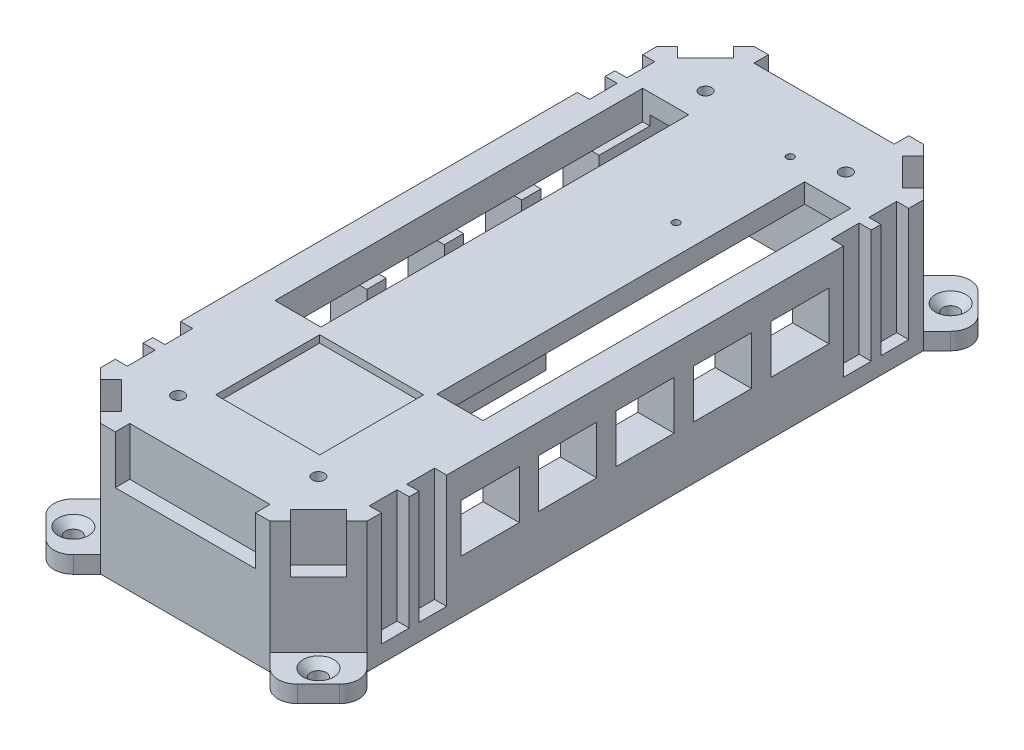
from build123d import *

# Parameters (mm, degrees)
SKETCH2_W                                       = 55
SKETCH2_H                                       = 135
BOSS_EXTRUDE1_DEPTH                             = 27
SKETCH3_W                                       = 40
SKETCH3_H                                       = 120
CUT_EXTRUDE1_DEPTH                              = 23
SKETCH19_W                                      = 12
SKETCH19_H                                      = 10
CUT_EXTRUDE7_DEPTH                              = 55
SKETCH20_R                                      = 1.25
SKETCH20_W                                      = 9.5
SKETCH20_H                                      = 76
CUT_EXTRUDE8_DEPTH                              = 6
CHAMFER1_SIZE                                   = 10
SKETCH22_R                                      = 0.75
CUT_EXTRUDE10_DEPTH                             = 10
SKETCH23_W                                      = 21.5
SKETCH23_H                                      = 21.5
CUT_EXTRUDE11_DEPTH                             = 1.5
SKETCH24_W                                      = 16
SKETCH24_H                                      = 24
BOSS_EXTRUDE2_DEPTH                             = 7
SKETCH26_W                                      = 11
SKETCH26_H                                      = 4.5
CUT_EXTRUDE13_DEPTH                             = 24
SKETCH27_W                                      = 14.142135623
SKETCH27_H                                      = 3.5
BOSS_EXTRUDE3_DEPTH                             = 8
SKETCH31_W                                      = 29
SKETCH31_H                                      = 10
CUT_EXTRUDE17_DEPTH                             = 3
SKETCH32_W                                      = 8.142135623
SKETCH32_H                                      = 10
CUT_EXTRUDE18_DEPTH                             = 3
MIRROR8_COPY_1_SKETCH_W                         = 8.142135623
MIRROR8_COPY_1_SKETCH_H                         = 10
MIRROR8_COPY_1_DEPTH                            = 3
CSK_FOR_M3_FLAT_HEAD_MACHINE_SCREW2_D           = 3.2
CSK_FOR_M3_FLAT_HEAD_MACHINE_SCREW2_CSINK_D     = 6.3
CSK_FOR_M3_FLAT_HEAD_MACHINE_SCREW2_CSINK_ANGLE = 90
FILLET3_R                                       = 4
MIRROR14_COPY_1_SKETCH_W                        = 14.142135623
MIRROR14_COPY_1_SKETCH_H                        = 3.5
MIRROR14_COPY_1_DEPTH                           = 8
FILLET3_OF_MIRROR14_R                           = 4
FILLET4_R                                       = 4
CSK_FOR_M3_FLAT_HEAD_MACHINE_SCREW3_D           = 3.2
CSK_FOR_M3_FLAT_HEAD_MACHINE_SCREW3_CSINK_D     = 6.3
CSK_FOR_M3_FLAT_HEAD_MACHINE_SCREW3_CSINK_ANGLE = 90
SKETCH46_W                                      = 5.75
SKETCH46_H                                      = 23.5
CUT_EXTRUDE20_DEPTH                             = 2.5


with BuildPart() as part:
    # Sketch2 → Boss-Extrude1 (new body)
    with BuildSketch(Plane(origin=(0, 0, 0), x_dir=(1, 0, 0), z_dir=(0, 1, 0))):
        Rectangle(SKETCH2_W, SKETCH2_H)
    extrude(amount=BOSS_EXTRUDE1_DEPTH)

    # Sketch3 → Cut-Extrude1 (cut)
    with BuildSketch(Plane.XZ):
        Rectangle(SKETCH3_W, SKETCH3_H)
    extrude(amount=-CUT_EXTRUDE1_DEPTH, mode=Mode.SUBTRACT)

    # Sketch19 → Cut-Extrude7 (cut)
    with BuildSketch(Plane(origin=(27.5, 0, 0), x_dir=(0, 0, -1), z_dir=(1, 0, 0))):
        with Locations((-32, 16)):
            Rectangle(SKETCH19_W, SKETCH19_H)
        with Locations((-16, 16)):
            Rectangle(SKETCH19_W, SKETCH19_H)
        with Locations((0, 16)):
            Rectangle(SKETCH19_W, SKETCH19_H)
        with Locations((16, 16)):
            Rectangle(SKETCH19_W, SKETCH19_H)
        with Locations((32, 16)):
            Rectangle(SKETCH19_W, SKETCH19_H)
    extrude(amount=-CUT_EXTRUDE7_DEPTH, mode=Mode.SUBTRACT)

    # Sketch20 → Cut-Extrude8 (cut)
    with BuildSketch(Plane(origin=(0, 27, 0), x_dir=(1, 0, 0), z_dir=(0, 1, 0))):
        with Locations(Location((-14.5, 54.5, 0), (0, 0, 270))):
            Circle(SKETCH20_R)
        with Locations(Location((14.5, 54.5, 0), (0, 0, 270))):
            Circle(SKETCH20_R)
        with Locations(Location((14.5, -54.5, 0), (0, 0, 270))):
            Circle(SKETCH20_R)
        with Locations(Location((-14.5, -54.5, 0), (0, 0, 270))):
            Circle(SKETCH20_R)
        with Locations((-16.75, 10.5)):
            Rectangle(SKETCH20_W, SKETCH20_H)
        with Locations((16.75, 10.5)):
            Rectangle(SKETCH20_W, SKETCH20_H)
    extrude(amount=-CUT_EXTRUDE8_DEPTH, mode=Mode.SUBTRACT)

    # Chamfer1
    chamfer1_edges = [part.edges().sort_by_distance(p)[0] for p in [
        (-27.5, 13.5, -67.5),
        (27.5, 13.5, -67.5),
        (27.5, 13.5, 67.5),
        (-27.5, 13.5, 67.5),
    ]]
    chamfer(chamfer1_edges, length=CHAMFER1_SIZE)

    # Sketch22 → Cut-Extrude10 (cut)
    with BuildSketch(Plane(origin=(0, 27, 0), x_dir=(1, 0, 0), z_dir=(0, 1, 0))):
        with Locations(Location((6, 51.5, 0), (0, 0, 270))):
            Circle(SKETCH22_R)
        with Locations(Location((6, 27.9, 0), (0, 0, 270))):
            Circle(SKETCH22_R)
    extrude(amount=-CUT_EXTRUDE10_DEPTH, mode=Mode.SUBTRACT)

    # Sketch23 → Cut-Extrude11 (cut)
    with BuildSketch(Plane(origin=(0, 27, 0), x_dir=(1, 0, 0), z_dir=(0, 1, 0))):
        with Locations((0, -39.75)):
            Rectangle(SKETCH23_W, SKETCH23_H)
    extrude(amount=-CUT_EXTRUDE11_DEPTH, mode=Mode.SUBTRACT)

    # Sketch24 → Boss-Extrude2 (add)
    with BuildSketch(Plane.XZ.offset(-23)):
        with Locations((0, 13)):
            Rectangle(SKETCH24_W, SKETCH24_H)
    extrude(amount=BOSS_EXTRUDE2_DEPTH)

    # Sketch26 → Cut-Extrude13 (cut)
    with BuildSketch(Plane.XY.offset(25)):
        with Locations((0, 20.75)):
            Rectangle(SKETCH26_W, SKETCH26_H)
    extrude(amount=-CUT_EXTRUDE13_DEPTH, mode=Mode.SUBTRACT)

    # Sketch27 → Boss-Extrude3 (add)
    with BuildSketch(Plane(origin=(-42.5, 0, 42.5), x_dir=(0.7071067811865465, 0, 0.7071067811865487), z_dir=(-0.7071067811865487, 0, 0.7071067811865465))):
        with Locations((28.284271248, 1.75)):
            Rectangle(SKETCH27_W, SKETCH27_H)
    boss_extrude3 = extrude(amount=BOSS_EXTRUDE3_DEPTH)

    # Mirror1: Boss-Extrude3 across plane
    add(boss_extrude3.mirror(Plane(origin=(0, 0, 0), x_dir=(0, 0, 1), z_dir=(1, 0, 0))))

    # Sketch31 → Cut-Extrude17 (cut)
    with BuildSketch(Plane.XY.offset(67.5)):
        with Locations((0, 22)):
            Rectangle(SKETCH31_W, SKETCH31_H)
    cut_extrude17 = extrude(amount=-CUT_EXTRUDE17_DEPTH, mode=Mode.SUBTRACT)

    # Sketch32 → Cut-Extrude18 (cut)
    with BuildSketch(Plane(origin=(42.5, 0, 42.5), x_dir=(0.7071067811865495, 0, -0.7071067811865456), z_dir=(0.7071067811865456, 0, 0.7071067811865495))):
        with Locations((-28.284271248, 22)):
            Rectangle(SKETCH32_W, SKETCH32_H)
    cut_extrude18 = extrude(amount=-CUT_EXTRUDE18_DEPTH, mode=Mode.SUBTRACT)

    # Mirror7: Cut-Extrude18 across plane
    add(cut_extrude18.mirror(Plane(origin=(0, 0, 0), x_dir=(0, 0, 1), z_dir=(1, 0, 0))), mode=Mode.SUBTRACT)

    # Mirror8: Cut-Extrude18 across plane
    add(cut_extrude18.mirror(Plane.XY), mode=Mode.SUBTRACT)

    # Mirror8 copy 1 sketch → Mirror8 copy 1 (cut)
    with BuildSketch(Plane(origin=(-42.5, 0, -42.5), x_dir=(-0.7071067811865495, 0, 0.7071067811865456), z_dir=(-0.7071067811865456, 0, -0.7071067811865495))):
        with Locations((-28.284271248, 22)):
            Rectangle(MIRROR8_COPY_1_SKETCH_W, MIRROR8_COPY_1_SKETCH_H)
    extrude(amount=-MIRROR8_COPY_1_DEPTH, mode=Mode.SUBTRACT)

    # Mirror9: Cut-Extrude17 across plane
    add(cut_extrude17.mirror(Plane.XY), mode=Mode.SUBTRACT)

    # CSK for M3 Flat Head Machine Screw2 (through all)
    with Locations(Plane(origin=(25.329182182, 3.5, 65.327672068), x_dir=(1, 0, 0), z_dir=(0, 1, 0))):
        with Locations((0, 0)):
            CounterSinkHole(CSK_FOR_M3_FLAT_HEAD_MACHINE_SCREW2_D / 2, CSK_FOR_M3_FLAT_HEAD_MACHINE_SCREW2_CSINK_D / 2, counter_sink_angle=CSK_FOR_M3_FLAT_HEAD_MACHINE_SCREW2_CSINK_ANGLE)

    # Fillet3
    fillet3_edges = [part.edges().sort_by_distance(p)[0] for p in [
        (33.156854249, 1.75, 63.156854249),
        (23.156854249, 1.75, 73.156854249),
    ]]
    fillet(fillet3_edges, radius=FILLET3_R)

    # Mirror14: Boss-Extrude3 across plane
    add(boss_extrude3.mirror(Plane.XY))

    # Mirror14 copy 1 sketch → Mirror14 copy 1 (add)
    with BuildSketch(Plane(origin=(42.5, 0, -42.5), x_dir=(-0.7071067811865465, 0, -0.7071067811865487), z_dir=(0.7071067811865487, 0, -0.7071067811865465))):
        with Locations((28.284271248, 1.75)):
            Rectangle(MIRROR14_COPY_1_SKETCH_W, MIRROR14_COPY_1_SKETCH_H)
    extrude(amount=MIRROR14_COPY_1_DEPTH)

    # Fillet3 of Mirror14
    fillet3_of_mirror14_edges = [part.edges().sort_by_distance(p)[0] for p in [
        (33.156854249, 1.75, -63.156854249),
        (23.156854249, 1.75, -73.156854249),
    ]]
    fillet(fillet3_of_mirror14_edges, radius=FILLET3_OF_MIRROR14_R)

    # Fillet4
    fillet4_edges = [part.edges().sort_by_distance(p)[0] for p in [
        (-33.156854249, 1.75, 63.156854249),
        (-23.156854249, 1.75, 73.156854249),
        (-33.156854249, 1.75, -63.156854249),
        (-23.156854249, 1.75, -73.156854249),
    ]]
    fillet(fillet4_edges, radius=FILLET4_R)

    # CSK for M3 Flat Head Machine Screw3 (through all)
    with Locations(Plane(origin=(-25.327672068, 3.5, 65.329182182), x_dir=(1, 0, 0), z_dir=(0, 1, 0))):
        with Locations((0, 0), (-0.001510114, 130.65685425), (50.65685425, 130.65685425)):
            CounterSinkHole(CSK_FOR_M3_FLAT_HEAD_MACHINE_SCREW3_D / 2, CSK_FOR_M3_FLAT_HEAD_MACHINE_SCREW3_CSINK_D / 2, counter_sink_angle=CSK_FOR_M3_FLAT_HEAD_MACHINE_SCREW3_CSINK_ANGLE)

    # Sketch46 → Cut-Extrude20 (cut)
    with BuildSketch(Plane(origin=(27.5, 0, 0), x_dir=(0, 0, -1), z_dir=(1, 0, 0))):
        with Locations((-51.625, 15.25)):
            Rectangle(SKETCH46_W, SKETCH46_H)
        with Locations((-43.875, 15.25)):
            Rectangle(SKETCH46_W, SKETCH46_H)
        with Locations((43.875, 15.25)):
            Rectangle(SKETCH46_W, SKETCH46_H)
        with Locations((51.625, 15.25)):
            Rectangle(SKETCH46_W, SKETCH46_H)
    cut_extrude20 = extrude(amount=-CUT_EXTRUDE20_DEPTH, mode=Mode.SUBTRACT)

    # Mirror15: Cut-Extrude20 across plane
    add(cut_extrude20.mirror(Plane(origin=(0, 0, 0), x_dir=(0, 0, 1), z_dir=(1, 0, 0))), mode=Mode.SUBTRACT)


solid = part.part
